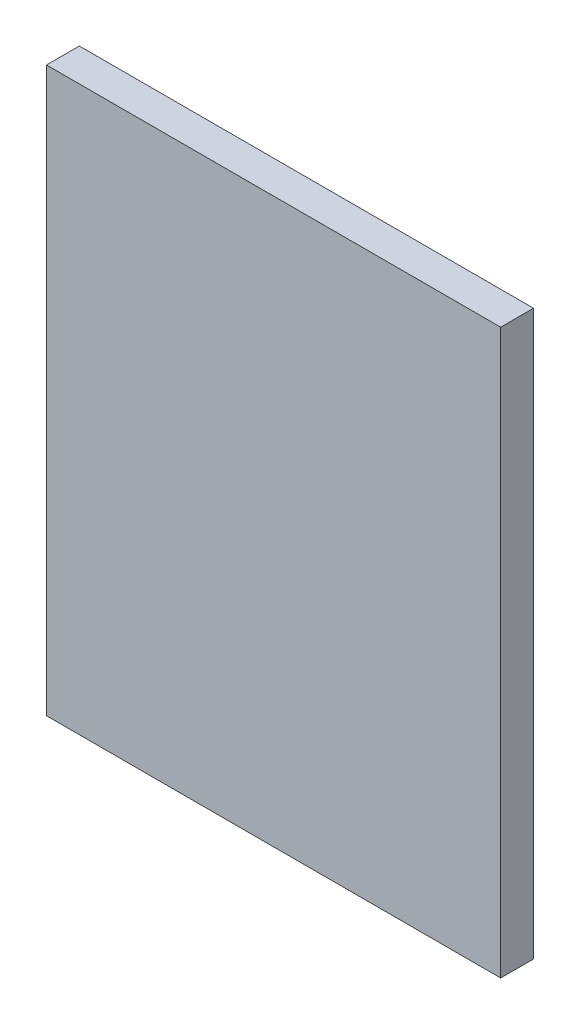
from build123d import *

# Parameters (mm, degrees)
SKETCH3_W           = 166
SKETCH3_H           = 206
BOSS_EXTRUDE2_DEPTH = 12


with BuildPart() as part:
    # Sketch3 → Boss-Extrude2 (new body)
    with BuildSketch(Plane.XY):
        with Locations((500, 103)):
            Rectangle(SKETCH3_W, SKETCH3_H)
    extrude(amount=BOSS_EXTRUDE2_DEPTH)


solid = part.part
